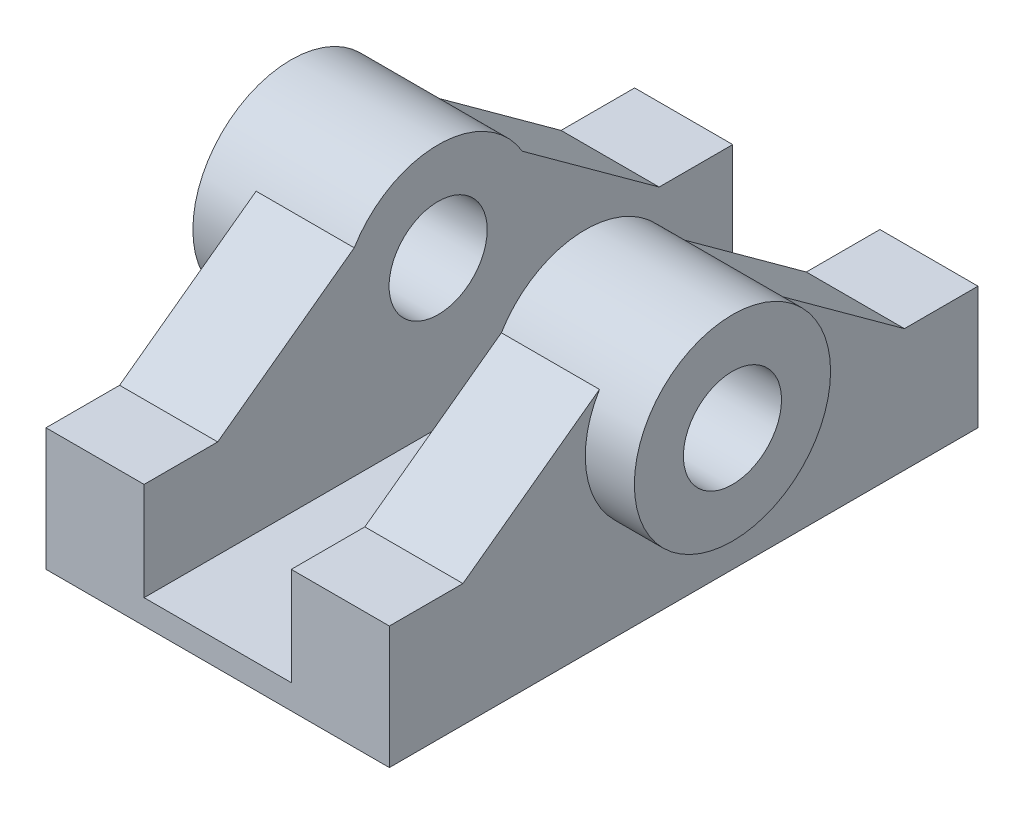
from build123d import *

# Parameters (mm, degrees)
SKETCH1_R           = 20
SKETCH1_R_2         = 10
BOSS_EXTRUDE2_DEPTH = 20
BOSS_EXTRUDE3_START = 10
SKETCH2_R           = 20
SKETCH2_R_2         = 10
BOSS_EXTRUDE3_DEPTH = 10
SKETCH3_W           = 15
SKETCH3_H           = 5
BOSS_EXTRUDE4_DEPTH = 120


with BuildPart() as part:
    # Sketch1 → Boss-Extrude2 (new body)
    # profile 1 of 2: a face of its own
    with BuildSketch(Plane(origin=(0, 0, 0), x_dir=(0, 0, -1), z_dir=(1, 0, 0))):
        with BuildLine():
            Line((-55.154478161, 25), (-55.154478161, 0))
            Line((-55.154478161, 0), (64.845521839, 0))
            Line((64.845521839, 0), (64.845521839, 25))
            Line((64.845521839, 25), (49.845521839, 25))
            Line((49.845521839, 25), (21.950490606, 45.270819657))
            ThreePointArc((21.950490606, 45.270819657), (24.06645602, 40.32794394), (24.789189269, 35))
            ThreePointArc((24.789189269, 35), (-0.58635613, 15.735952874), (-12.321161896, 45.35547599))
            Line((-12.321161896, 45.35547599), (-40.154478161, 25))
            Line((-40.154478161, 25), (-55.154478161, 25))
        make_face()
    # profile 2 of 2: a face of its own
    with BuildSketch(Plane(origin=(0, 0, 0), x_dir=(0, 0, -1), z_dir=(1, 0, 0))):
        with Locations((4.789189269, 35)):
            Circle(SKETCH1_R)
        with Locations((4.789189269, 35)):
            Circle(SKETCH1_R_2, mode=Mode.SUBTRACT)
    extrude(amount=-BOSS_EXTRUDE2_DEPTH)

    # Sketch2 → Boss-Extrude3 (add)
    with BuildSketch(Plane(origin=(0, 0, 0), x_dir=(0, 0, -1), z_dir=(1, 0, 0)).offset(BOSS_EXTRUDE3_START)):
        with Locations((4.789189269, 35)):
            Circle(SKETCH2_R)
        with Locations((4.789189269, 35)):
            Circle(SKETCH2_R_2, mode=Mode.SUBTRACT)
    extrude(amount=-BOSS_EXTRUDE3_DEPTH)

    # Sketch3 → Boss-Extrude4 (add)
    with BuildSketch(Plane.XY.offset(55.154478161)):
        with Locations((-27.5, 2.5)):
            Rectangle(SKETCH3_W, SKETCH3_H)
    extrude(amount=-BOSS_EXTRUDE4_DEPTH)

    # Mirror1: part across plane


with BuildPart() as part_1:
    add(part.part)
    add(part.part.mirror(Plane.ZY.offset(35)))


solid = part_1.part
